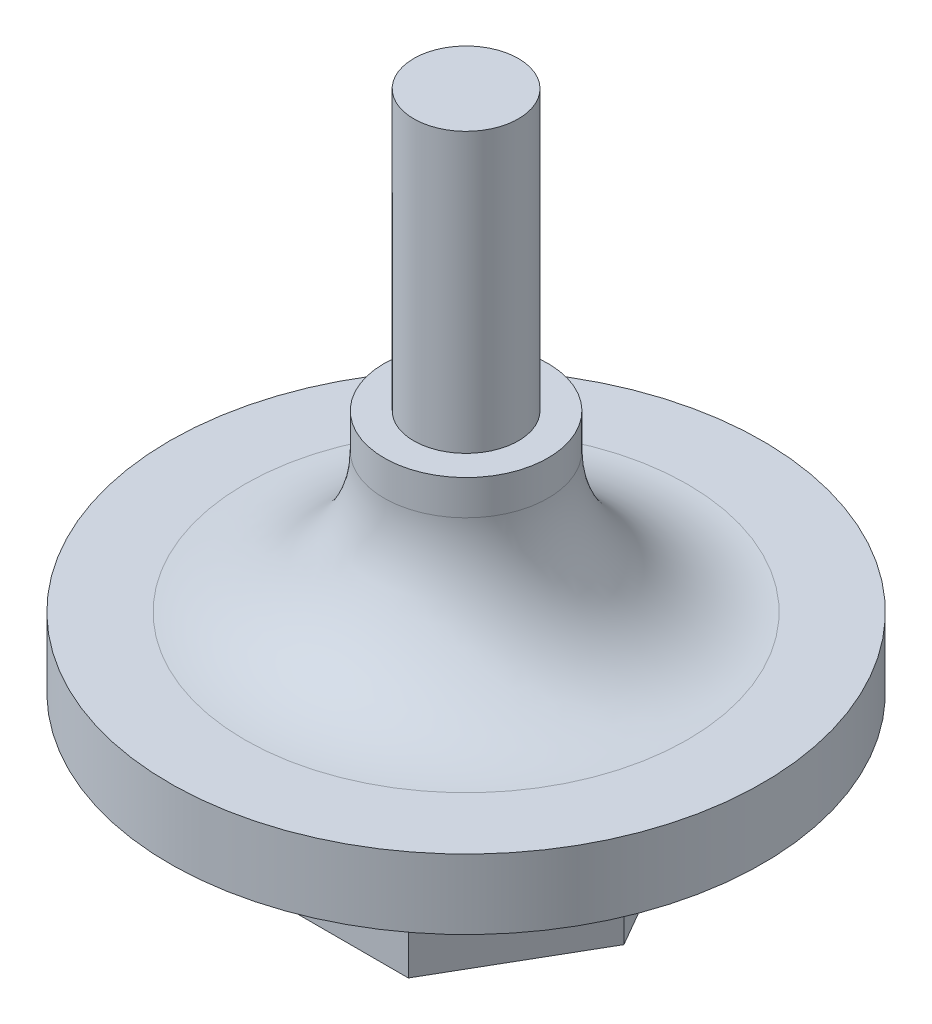
from build123d import *

# Parameters (mm, degrees)
BOSS_EXTRUDE1_DEPTH = 6.35


with BuildPart() as part:
    # Sketch1 → Revolve1 (revolve)
    with BuildSketch(Plane.XY, mode=Mode.PRIVATE) as revolve1_sk:
        with BuildLine():
            Line((0, 0), (13.5, 0))
            Line((13.5, 0), (13.5, 3.175))
            Line((13.5, 3.175), (10.08, 3.175))
            ThreePointArc((10.08, 3.175), (5.589871939, 5.034871939), (3.73, 9.525))
            Line((3.73, 9.525), (3.73, 11.1125))
            Line((3.73, 11.1125), (2.38125, 11.1125))
            Line((2.38125, 11.1125), (2.38125, 23.8125))
            Line((2.38125, 23.8125), (0, 23.8125))
            Line((0, 23.8125), (0, 0))
        make_face()
    revolve(revolve1_sk.sketch.rotate(Axis((0, 23.8125, 0), (0, -1, 0)), 180), axis=Axis((0, 23.8125, 0), (0, -1, 0)))

    # Sketch2 → Boss-Extrude1 (add)
    with BuildSketch(Plane.XZ):
        Polygon((7.18570145, 0), (3.592850725, 6.223), (-3.592850725, 6.223), (-7.18570145, 0), (-3.592850725, -6.223), (3.592850725, -6.223), align=None)
    extrude(amount=BOSS_EXTRUDE1_DEPTH)


solid = part.part
